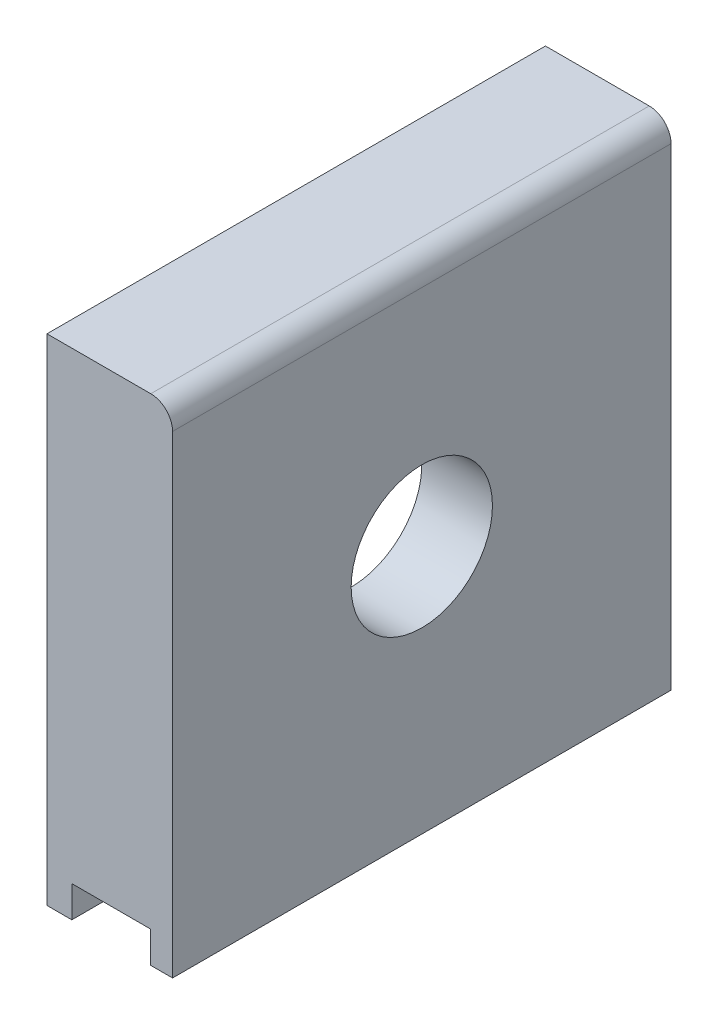
from build123d import *

# Parameters (mm, degrees)
BOSS_EXTRUDE1_DEPTH = 31.75
SKETCH2_R           = 11.25
SKETCH2_R_2         = 4.5
CUT_EXTRUDE1_DEPTH  = 3.5
CUT_EXTRUDE2_REACH  = 68.912
SKETCH3_R           = 4.5
SKETCH4_W           = 5
SKETCH4_H           = 31.75
CUT_EXTRUDE3_DEPTH  = 2
CHAMFER3_SIZE       = 0.25


with BuildPart() as part:
    # Sketch1 → Boss-Extrude1 (new body)
    with BuildSketch(Plane.XY):
        with BuildLine():
            Line((-22.425, -58.353679699), (-22.425, -28.204472455))
            ThreePointArc((-22.425, -28.204472455), (-22.831389341, -27.223361796), (-23.8125, -26.816972455))
            Line((-23.8125, -26.816972455), (-30.425, -26.816972455))
            Line((-30.425, -26.816972455), (-30.425, -58.353679699))
            Line((-30.425, -58.353679699), (-22.425, -58.353679699))
        make_face()
    extrude(amount=-BOSS_EXTRUDE1_DEPTH)

    # Sketch2 → Cut-Extrude1 (cut)
    with BuildSketch(Plane.ZY.offset(30.425)):
        with Locations((-15.875, -42.478679699)):
            Circle(SKETCH2_R)
        with Locations((-15.875, -42.478679699)):
            Circle(SKETCH2_R_2, mode=Mode.SUBTRACT)
    extrude(amount=-CUT_EXTRUDE1_DEPTH, mode=Mode.SUBTRACT)

    # Sketch3 → Cut-Extrude2 (cut, up to next)
    with BuildSketch(Plane.ZY.offset(30.425), mode=Mode.PRIVATE) as cut_extrude2_sk1:
        with Locations((-15.875, -42.478679699)):
            Circle(SKETCH3_R)
    cut_extrude2_tool1 = extrude(cut_extrude2_sk1.sketch, amount=-CUT_EXTRUDE2_REACH, mode=Mode.PRIVATE) & part.part
    add(cut_extrude2_tool1.solids().sort_by_distance((-30.425, -42.47868, -15.875))[0], mode=Mode.SUBTRACT)

    # Sketch4 → Cut-Extrude3 (cut)
    with BuildSketch(Plane.XZ.offset(58.353679699)):
        with Locations((-26.341152568, -15.875)):
            Rectangle(SKETCH4_W, SKETCH4_H)
    extrude(amount=-CUT_EXTRUDE3_DEPTH, mode=Mode.SUBTRACT)

    # Chamfer3
    chamfer3_edges = [part.edges().sort_by_distance(p)[0] for p in [
        (-30.425, -42.478679699, -27.125),
    ]]
    chamfer(chamfer3_edges, length=CHAMFER3_SIZE)


solid = part.part
